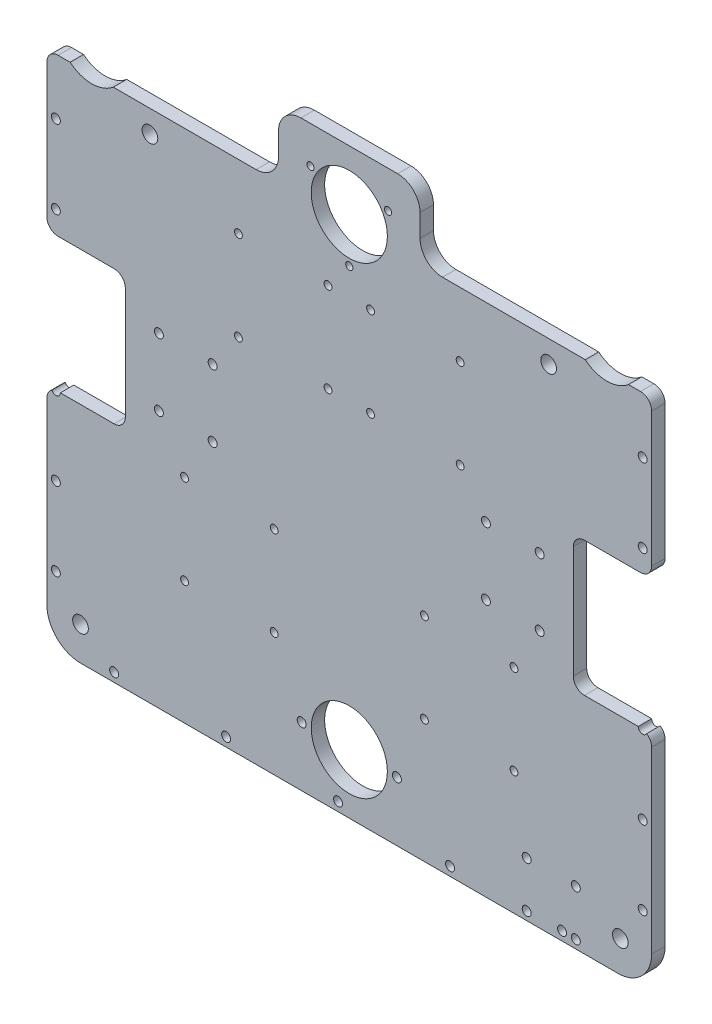
from build123d import *

# Parameters (mm, degrees)
SKETCH1_W            = 270
SKETCH1_H            = 260
BOSS_EXTRUDE1_DEPTH  = 6
SKETCH2_R            = 2
SKETCH2_W            = 35
SKETCH2_H            = 60
CUT_EXTRUDE1_DEPTH   = 188.512666239
SKETCH3_R            = 17
CUT_EXTRUDE2_DEPTH   = 188.512666239
SKETCH4_R            = 2
CUT_EXTRUDE3_DEPTH   = 188.512666239
SKETCH5_R            = 2
CUT_EXTRUDE4_DEPTH   = 188.512666239
FILLET1_R            = 15
SKETCH6_R            = 12.5
CUT_EXTRUDE5_DEPTH   = 188.512666239
SKETCH8_R            = 1.75
CUT_EXTRUDE6_DEPTH   = 188.512666239
SKETCH9_R            = 12.5
CUT_EXTRUDE7_DEPTH   = 188.512666239
SKETCH10_W           = 103.406579867
SKETCH10_H           = 30
CUT_EXTRUDE8_DEPTH   = 188.512666239
FILLET2_R            = 10
FILLET2_OF_MIRROR3_R = 10
SKETCH11_R           = 1.6
SKETCH11_R_2         = 3.5
CUT_EXTRUDE9_DEPTH   = 188.512666239
SKETCH12_R           = 15
CUT_EXTRUDE10_DEPTH  = 188.512666239
FILLET3_R            = 5
FILLET4_R            = 5
SKETCH13_R           = 1.75
SKETCH13_R_2         = 2
CUT_EXTRUDE11_DEPTH  = 188.512666239


with BuildPart() as part:
    # Sketch1 → Boss-Extrude1 (new body)
    with BuildSketch(Plane.XY):
        Rectangle(SKETCH1_W, SKETCH1_H)
    extrude(amount=BOSS_EXTRUDE1_DEPTH)

    # Sketch2 → Cut-Extrude1 (cut, through all)
    with BuildSketch(Plane.XY.offset(6)):
        with Locations((-85, 15)):
            Circle(SKETCH2_R)
        with Locations((-61, 15)):
            Circle(SKETCH2_R)
        with Locations((-61, -15)):
            Circle(SKETCH2_R)
        with Locations((-85, -15)):
            Circle(SKETCH2_R)
        with Locations((-117.5, 0)):
            Rectangle(SKETCH2_W, SKETCH2_H)
    cut_extrude1 = extrude(amount=-CUT_EXTRUDE1_DEPTH, mode=Mode.SUBTRACT)

    # Sketch3 → Cut-Extrude2 (cut, through all)
    with BuildSketch(Plane.XY.offset(6)):
        with Locations((0, -103.5)):
            Circle(SKETCH3_R)
    cut_extrude2 = extrude(amount=-CUT_EXTRUDE2_DEPTH, mode=Mode.SUBTRACT)

    # Mirror1: Cut-Extrude1 across plane
    add(cut_extrude1.mirror(Plane(origin=(0, 0, 0), x_dir=(0, 0, 1), z_dir=(1, 0, 0))), mode=Mode.SUBTRACT)

    # Mirror2: Cut-Extrude2 across plane
    add(cut_extrude2.mirror(Plane.ZX), mode=Mode.SUBTRACT)

    # Sketch4 → Cut-Extrude3 (cut, through all)
    with BuildSketch(Plane.XY.offset(6)):
        with Locations((21.25, -103.5)):
            Circle(SKETCH4_R)
        with Locations((-21.25, -103.5)):
            Circle(SKETCH4_R)
    extrude(amount=-CUT_EXTRUDE3_DEPTH, mode=Mode.SUBTRACT)

    # Sketch5 → Cut-Extrude4 (cut, through all)
    with BuildSketch(Plane.XY.offset(6)):
        with Locations((79.206538854, -126.234773755)):
            Circle(SKETCH5_R)
        with Locations((79.206538854, -105.765226245)):
            Circle(SKETCH5_R)
        with Locations((101.138196901, -105.765226245)):
            Circle(SKETCH5_R)
        with Locations((101.138196901, -126.234773755)):
            Circle(SKETCH5_R)
    extrude(amount=-CUT_EXTRUDE4_DEPTH, mode=Mode.SUBTRACT)

    # Fillet1
    fillet1_edges = [part.edges().sort_by_distance(p)[0] for p in [
        (135, -130, 3),
        (-135, -130, 3),
        (-135, 130, 3),
        (135, 130, 3),
    ]]
    fillet(fillet1_edges, radius=FILLET1_R)

    # Sketch6 → Cut-Extrude5 (cut, through all)
    with BuildSketch(Plane.XY.offset(6)):
        with Locations((-115, 115)):
            Circle(SKETCH6_R)
    extrude(amount=-CUT_EXTRUDE5_DEPTH, mode=Mode.SUBTRACT)

    # Sketch8 → Cut-Extrude6 (cut, through all)
    with BuildSketch(Plane.XY.offset(6)):
        with Locations((49.5, 31.3)):
            Circle(SKETCH8_R)
        with Locations((9.5, 31.3)):
            Circle(SKETCH8_R)
        with Locations((9.5, 71.3)):
            Circle(SKETCH8_R)
        with Locations((49.5, 71.3)):
            Circle(SKETCH8_R)
        with Locations((-49.5, 31.3)):
            Circle(SKETCH8_R)
        with Locations((-9.5, 31.3)):
            Circle(SKETCH8_R)
        with Locations((-49.5, 71.3)):
            Circle(SKETCH8_R)
        with Locations((-9.5, 71.3)):
            Circle(SKETCH8_R)
    extrude(amount=-CUT_EXTRUDE6_DEPTH, mode=Mode.SUBTRACT)

    # Sketch9 → Cut-Extrude7 (cut, through all)
    with BuildSketch(Plane.XY.offset(6)):
        with Locations((115, 111.5)):
            Circle(SKETCH9_R)
    extrude(amount=-CUT_EXTRUDE7_DEPTH, mode=Mode.SUBTRACT)

    # Sketch10 → Cut-Extrude8 (cut, through all)
    with BuildSketch(Plane.XY.offset(6)):
        with Locations((83.296710066, 115)):
            Rectangle(SKETCH10_W, SKETCH10_H)
    cut_extrude8 = extrude(amount=-CUT_EXTRUDE8_DEPTH, mode=Mode.SUBTRACT)

    # Fillet2
    fillet2_edges = [part.edges().sort_by_distance(p)[0] for p in [
        (31.593420133, 100, 3),
        (31.593420133, 130, 3),
    ]]
    fillet(fillet2_edges, radius=FILLET2_R)

    # Mirror3: Cut-Extrude8 across plane
    add(cut_extrude8.mirror(Plane.ZY), mode=Mode.SUBTRACT)

    # Fillet2 of Mirror3
    fillet2_of_mirror3_edges = [part.edges().sort_by_distance(p)[0] for p in [
        (-31.593420133, 100, 3),
        (-31.593420133, 130, 3),
    ]]
    fillet(fillet2_of_mirror3_edges, radius=FILLET2_OF_MIRROR3_R)

    # Sketch11 → Cut-Extrude9 (cut, through all)
    with BuildSketch(Plane.XY.offset(6)):
        with Locations((-17.320508076, 113.5)):
            Circle(SKETCH11_R)
        with Locations((17.320508076, 113.5)):
            Circle(SKETCH11_R)
        with Locations((0, 83.5)):
            Circle(SKETCH11_R)
        with Locations((89, 90)):
            Circle(SKETCH11_R_2)
        with Locations((-89, 90)):
            Circle(SKETCH11_R_2)
        with Locations((121, -116)):
            Circle(SKETCH11_R_2)
        with Locations((-120, -115)):
            Circle(SKETCH11_R_2)
    extrude(amount=-CUT_EXTRUDE9_DEPTH, mode=Mode.SUBTRACT)

    # Sketch12 → Cut-Extrude10 (cut, through all)
    with BuildSketch(Plane.XY.offset(6)):
        with Locations((115, 111.5)):
            Circle(SKETCH12_R)
        with Locations((-115, 111.5)):
            Circle(SKETCH12_R)
    extrude(amount=-CUT_EXTRUDE10_DEPTH, mode=Mode.SUBTRACT)

    # Fillet3
    fillet3_edges = [part.edges().sort_by_distance(p)[0] for p in [
        (135, 100, 3),
        (-135, 100, 3),
    ]]
    fillet(fillet3_edges, radius=FILLET3_R)

    # Fillet4
    fillet4_edges = [part.edges().sort_by_distance(p)[0] for p in [
        (-100, 30, 3),
        (-100, -30, 3),
        (-135, -30, 3),
        (-135, 30, 3),
        (100, -30, 3),
        (100, 30, 3),
        (135, 30, 3),
        (135, -30, 3),
    ]]
    fillet(fillet4_edges, radius=FILLET4_R)

    # Sketch13 → Cut-Extrude11 (cut, through all)
    with BuildSketch(Plane.XY.offset(6)):
        with Locations((33.544641935, -34.940258228)):
            Circle(SKETCH13_R)
        with Locations((73.544641935, -34.940258228)):
            Circle(SKETCH13_R)
        with Locations((73.544641935, -74.940258228)):
            Circle(SKETCH13_R)
        with Locations((33.544641935, -74.940258228)):
            Circle(SKETCH13_R)
        with Locations(Location((-33.544641935, -74.940258228, 0), (0, 0, 180))):
            Circle(SKETCH13_R)
        with Locations(Location((-73.544641935, -74.940258228, 0), (0, 0, 180))):
            Circle(SKETCH13_R)
        with Locations(Location((-73.544641935, -34.940258228, 0), (0, 0, 180))):
            Circle(SKETCH13_R)
        with Locations(Location((-33.544641935, -34.940258228, 0), (0, 0, 180))):
            Circle(SKETCH13_R)
        with Locations((-131, -100)):
            Circle(SKETCH13_R_2)
        with Locations((-131, -65)):
            Circle(SKETCH13_R_2)
        with Locations((-131, -30)):
            Circle(SKETCH13_R_2)
        with Locations((-131, 5)):
            Circle(SKETCH13_R_2)
        with Locations((-131, 40)):
            Circle(SKETCH13_R_2)
        with Locations((-131, 75)):
            Circle(SKETCH13_R_2)
        with Locations((-105, -126)):
            Circle(SKETCH13_R_2)
        with Locations((-55, -126)):
            Circle(SKETCH13_R_2)
        with Locations((-5, -126)):
            Circle(SKETCH13_R_2)
        with Locations((45, -126)):
            Circle(SKETCH13_R_2)
        with Locations((95, -126)):
            Circle(SKETCH13_R_2)
        with Locations((145, -126)):
            Circle(SKETCH13_R_2)
        with Locations((195, -126)):
            Circle(SKETCH13_R_2)
        with Locations((245, -126)):
            Circle(SKETCH13_R_2)
        with Locations((295, -126)):
            Circle(SKETCH13_R_2)
        with Locations((345, -126)):
            Circle(SKETCH13_R_2)
        with Locations((395, -126)):
            Circle(SKETCH13_R_2)
        with Locations((445, -126)):
            Circle(SKETCH13_R_2)
        with Locations((495, -126)):
            Circle(SKETCH13_R_2)
        with Locations(Location((131, 75, 0), (0, 0, 180))):
            Circle(SKETCH13_R_2)
        with Locations(Location((131, 40, 0), (0, 0, 180))):
            Circle(SKETCH13_R_2)
        with Locations((131, 5)):
            Circle(SKETCH13_R_2)
        with Locations((131, -30)):
            Circle(SKETCH13_R_2)
        with Locations(Location((131, -65, 0), (0, 0, 180))):
            Circle(SKETCH13_R_2)
        with Locations(Location((131, -100, 0), (0, 0, 180))):
            Circle(SKETCH13_R_2)
    extrude(amount=-CUT_EXTRUDE11_DEPTH, mode=Mode.SUBTRACT)


solid = part.part
